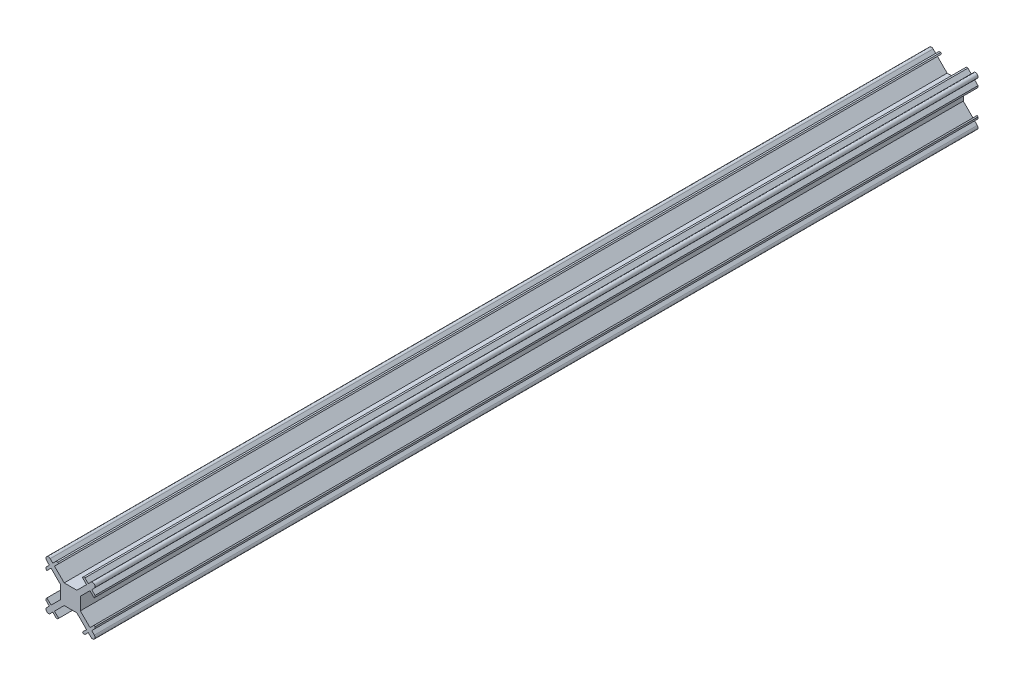
from build123d import *

# Parameters (mm, degrees)
BOSS_EXTRUDE1_DEPTH = 90


with BuildPart() as part:
    # Sketch2 → Boss-Extrude1 (new, symmetric)
    with BuildSketch(Plane.XY):
        with BuildLine():
            Line((-4.853553391, 4.146446609), (-4.323223305, 3.616116524))
            Line((-4.323223305, 3.616116524), (-5, 2.939339828))
            Line((-5, 2.939339828), (-5, 2.595836944))
            Line((-5, 2.595836944), (-4.818198052, 2.414034995))
            Line((-4.818198052, 2.414034995), (-3.969669914, 3.262563133))
            Line((-3.969669914, 3.262563133), (-2, 1.292893219))
            Line((-2, 1.292893219), (-2, -1.292893219))
            Line((-2, -1.292893219), (-3.969669914, -3.262563133))
            Line((-3.969669914, -3.262563133), (-4.818198052, -2.414034995))
            Line((-4.818198052, -2.414034995), (-5, -2.595836944))
            Line((-5, -2.595836944), (-5, -2.939339828))
            Line((-5, -2.939339828), (-4.323223305, -3.616116524))
            Line((-4.323223305, -3.616116524), (-4.853553391, -4.146446609))
            ThreePointArc((-4.853553391, -4.146446609), (-4.853553391, -4.853553391), (-4.146446609, -4.853553391))
            Line((-4.146446609, -4.853553391), (-3.616116524, -4.323223305))
            Line((-3.616116524, -4.323223305), (-2.939339828, -5))
            Line((-2.939339828, -5), (-2.595836944, -5))
            Line((-2.595836944, -5), (-2.414034995, -4.818198052))
            Line((-2.414034995, -4.818198052), (-3.262563133, -3.969669914))
            Line((-3.262563133, -3.969669914), (-1.292893219, -2))
            Line((-1.292893219, -2), (1.292893219, -2))
            Line((1.292893219, -2), (3.262563133, -3.969669914))
            Line((3.262563133, -3.969669914), (2.414034995, -4.818198052))
            Line((2.414034995, -4.818198052), (2.595836944, -5))
            Line((2.595836944, -5), (2.939339828, -5))
            Line((2.939339828, -5), (3.616116524, -4.323223305))
            Line((3.616116524, -4.323223305), (4.146446609, -4.853553391))
            ThreePointArc((4.146446609, -4.853553391), (4.853553391, -4.853553391), (4.853553391, -4.146446609))
            Line((4.853553391, -4.146446609), (4.323223305, -3.616116524))
            Line((4.323223305, -3.616116524), (5, -2.939339828))
            Line((5, -2.939339828), (5, -2.595836944))
            Line((5, -2.595836944), (4.818198052, -2.414034995))
            Line((4.818198052, -2.414034995), (3.969669914, -3.262563133))
            Line((3.969669914, -3.262563133), (2, -1.292893219))
            Line((2, -1.292893219), (2, 1.292893219))
            Line((2, 1.292893219), (3.969669914, 3.262563133))
            Line((3.969669914, 3.262563133), (4.818198052, 2.414034995))
            Line((4.818198052, 2.414034995), (5, 2.595836944))
            Line((5, 2.595836944), (5, 2.939339828))
            Line((5, 2.939339828), (4.323223305, 3.616116524))
            Line((4.323223305, 3.616116524), (4.853553391, 4.146446609))
            ThreePointArc((4.853553391, 4.146446609), (4.853553391, 4.853553391), (4.146446609, 4.853553391))
            Line((4.146446609, 4.853553391), (3.616116524, 4.323223305))
            Line((3.616116524, 4.323223305), (2.939339828, 5))
            Line((2.939339828, 5), (2.595836944, 5))
            Line((2.595836944, 5), (2.414034995, 4.818198052))
            Line((2.414034995, 4.818198052), (3.262563133, 3.969669914))
            Line((3.262563133, 3.969669914), (1.292893219, 2))
            Line((1.292893219, 2), (-1.292893219, 2))
            Line((-1.292893219, 2), (-3.262563133, 3.969669914))
            Line((-3.262563133, 3.969669914), (-2.414034995, 4.818198052))
            Line((-2.414034995, 4.818198052), (-2.595836944, 5))
            Line((-2.595836944, 5), (-2.939339828, 5))
            Line((-2.939339828, 5), (-3.616116524, 4.323223305))
            Line((-3.616116524, 4.323223305), (-4.146446609, 4.853553391))
            ThreePointArc((-4.146446609, 4.853553391), (-4.853553391, 4.853553391), (-4.853553391, 4.146446609))
        make_face()
    extrude(amount=BOSS_EXTRUDE1_DEPTH, both=True)


solid = part.part
